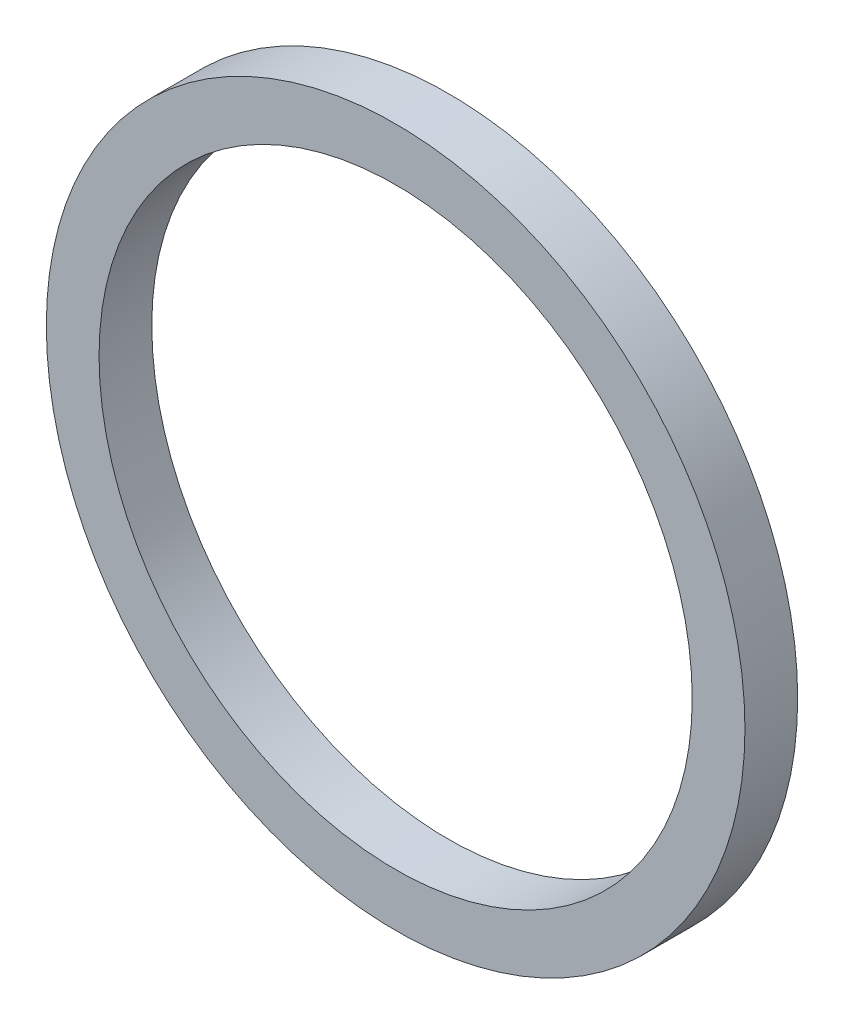
from build123d import *

# Parameters (mm, degrees)
ESBO_O1_R                = 45
RESSALTO_EXTRUS_O1_DEPTH = 8


with BuildPart() as part:
    # Esboço1 → Ressalto-extrusão1 (new body)
    with BuildSketch(Plane.XY):
        with BuildLine():
            ThreePointArc((-5, -52.763623833), (-2.502792125, -52.940872977), (0, -53))
            ThreePointArc((0, -53), (2.502792125, -52.940872977), (5, -52.763623833))
            ThreePointArc((5, -52.763623833), (0, 53), (-5, -52.763623833))
        make_face()
        Circle(ESBO_O1_R, mode=Mode.SUBTRACT)
    extrude(amount=RESSALTO_EXTRUS_O1_DEPTH)


solid = part.part
